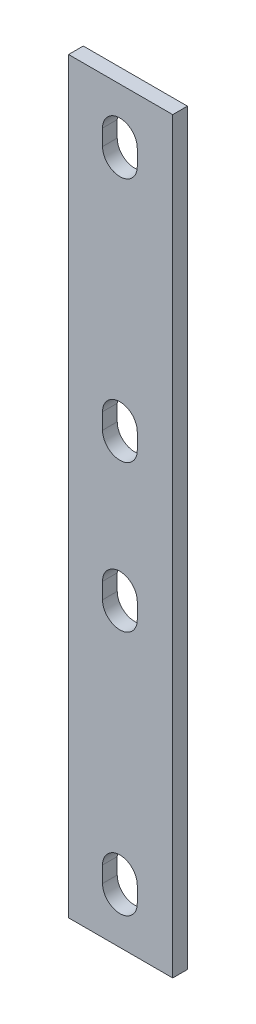
from build123d import *

# Parameters (mm, degrees)
SKETCH1_W           = 39
SKETCH1_H           = 280
BOSS_EXTRUDE1_DEPTH = 5.5
CUT_EXTRUDE2_DEPTH  = 6


with BuildPart() as part:
    # Sketch1 → Boss-Extrude1 (new body)
    with BuildSketch(Plane.XY):
        with Locations((19.5, -140)):
            Rectangle(SKETCH1_W, SKETCH1_H)
    extrude(amount=BOSS_EXTRUDE1_DEPTH)

    # Sketch4 → Cut-Extrude2 (cut)
    with BuildSketch(Plane.XY.offset(5.5)):
        with BuildLine():
            Line((25.717260001, -170.5), (25.717260001, -164.5))
            ThreePointArc((25.717260001, -164.5), (19.217260001, -158), (12.717260001, -164.5))
            Line((12.717260001, -164.5), (12.717260001, -170.5))
            ThreePointArc((12.717260001, -170.5), (19.217260001, -177), (25.717260001, -170.5))
        make_face()
        with BuildLine():
            Line((25.717260001, -109.5), (25.717260001, -115.5))
            ThreePointArc((25.717260001, -115.5), (19.217260001, -122), (12.717260001, -115.5))
            Line((12.717260001, -115.5), (12.717260001, -109.5))
            ThreePointArc((12.717260001, -109.5), (19.217260001, -103), (25.717260001, -109.5))
        make_face()
        with BuildLine():
            Line((25.717260001, -23.5), (25.717260001, -17.5))
            ThreePointArc((25.717260001, -17.5), (19.217260001, -11), (12.717260001, -17.5))
            Line((12.717260001, -17.5), (12.717260001, -23.5))
            ThreePointArc((12.717260001, -23.5), (19.217260001, -30), (25.717260001, -23.5))
        make_face()
        with BuildLine():
            Line((25.717260001, -256.5), (25.717260001, -262.5))
            ThreePointArc((25.717260001, -262.5), (19.217260001, -269), (12.717260001, -262.5))
            Line((12.717260001, -262.5), (12.717260001, -256.5))
            ThreePointArc((12.717260001, -256.5), (19.217260001, -250), (25.717260001, -256.5))
        make_face()
    extrude(amount=-CUT_EXTRUDE2_DEPTH, mode=Mode.SUBTRACT)


solid = part.part
